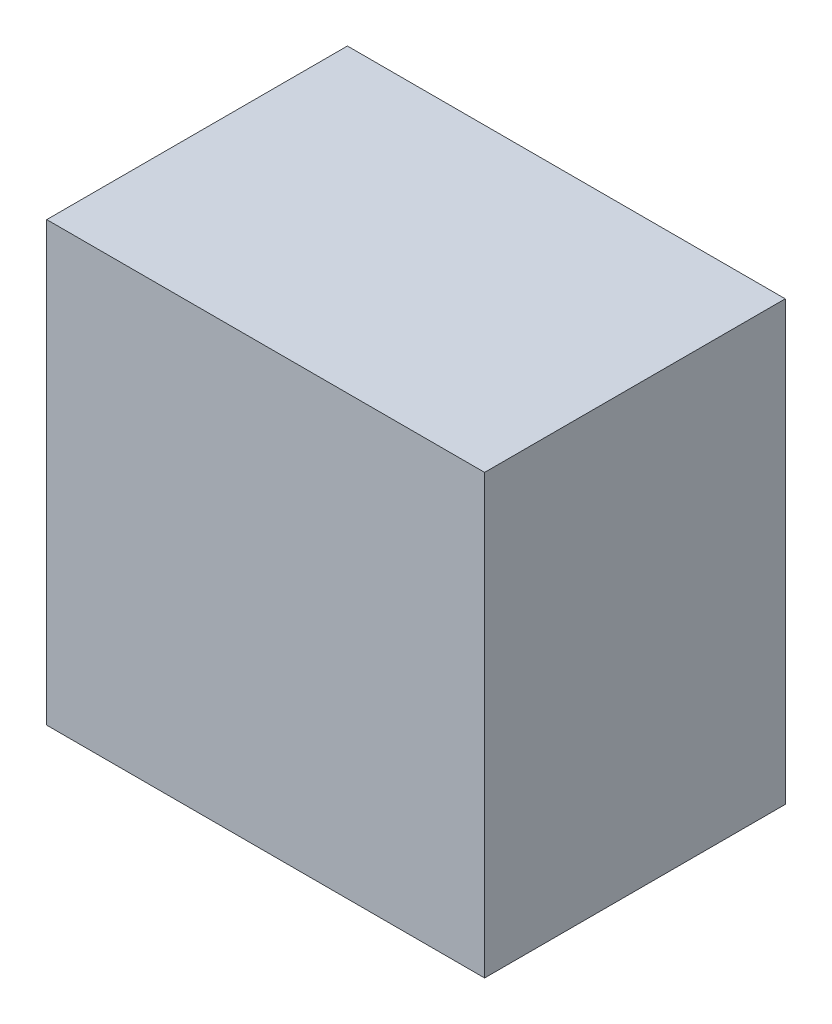
from build123d import *

# Parameters (mm, degrees)
SKETCH1_W           = 15
SKETCH1_H           = 15
BOSS_EXTRUDE1_DEPTH = 10.3


with BuildPart() as part:
    # Sketch1 → Boss-Extrude1 (new body)
    with BuildSketch(Plane.XY):
        Rectangle(SKETCH1_W, SKETCH1_H)
    extrude(amount=BOSS_EXTRUDE1_DEPTH)


solid = part.part
